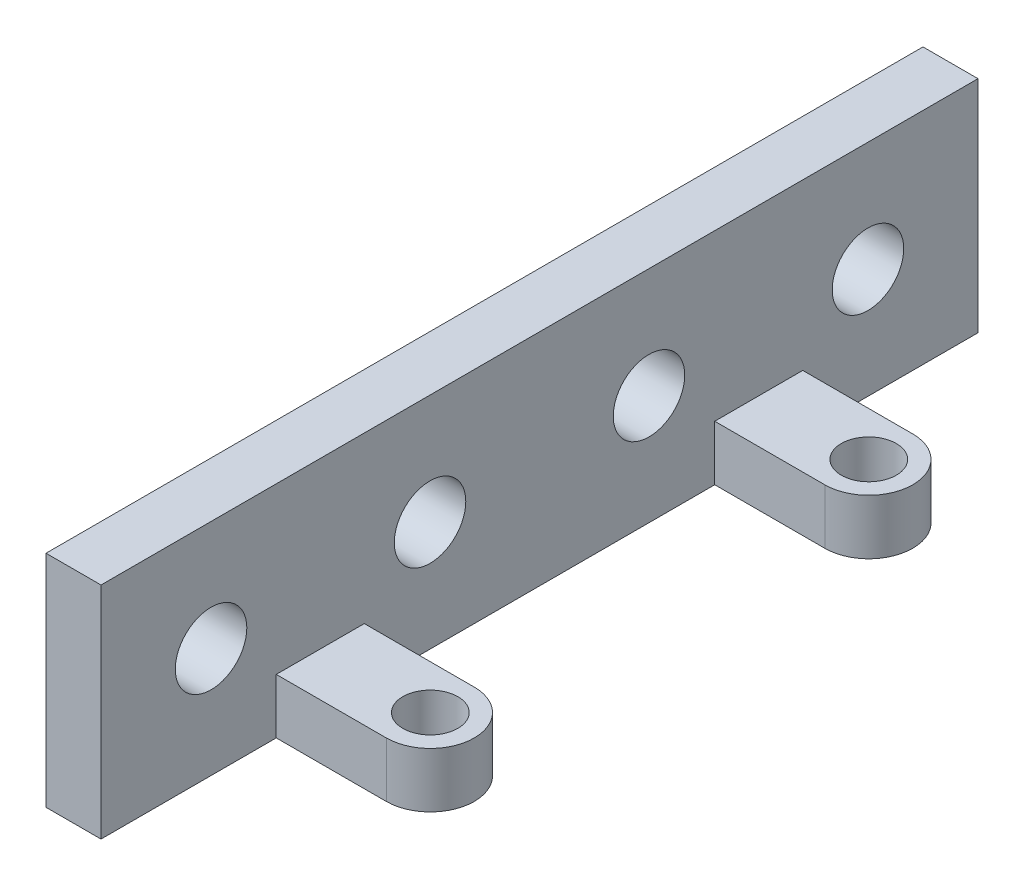
from build123d import *

# Parameters (mm, degrees)
SKETCH1_W           = 79.7
SKETCH1_H           = 20
SKETCH1_R           = 3.25
BOSS_EXTRUDE1_DEPTH = 5
SKETCH2_W           = 8
SKETCH2_H           = 5
BOSS_EXTRUDE2_DEPTH = 10
BOSS_EXTRUDE3_DEPTH = 5
SKETCH3_6_R         = 2.5
CUT_EXTRUDE2_DEPTH  = 84.295197941


with BuildPart() as part:
    # Sketch1 → Boss-Extrude1 (new body)
    with BuildSketch(Plane(origin=(0, 0, 0), x_dir=(0, 0, -1), z_dir=(1, 0, 0))):
        with Locations((-39.85, 10)):
            Rectangle(SKETCH1_W, SKETCH1_H)
        with Locations((-29.9, 10)):
            Circle(SKETCH1_R, mode=Mode.SUBTRACT)
        with Locations((-49.8, 10)):
            Circle(SKETCH1_R, mode=Mode.SUBTRACT)
        with Locations((-69.7, 10)):
            Circle(SKETCH1_R, mode=Mode.SUBTRACT)
        with Locations((-10, 10)):
            Circle(SKETCH1_R, mode=Mode.SUBTRACT)
    extrude(amount=BOSS_EXTRUDE1_DEPTH)

    # Sketch2 → Boss-Extrude2 (add)
    with BuildSketch(Plane(origin=(5, 0, 0), x_dir=(0, 0, -1), z_dir=(1, 0, 0))):
        with Locations((-19.925, 2.5)):
            Rectangle(SKETCH2_W, SKETCH2_H)
        with Locations((-59.775, 2.5)):
            Rectangle(SKETCH2_W, SKETCH2_H)
    extrude(amount=BOSS_EXTRUDE2_DEPTH)

    # Sketch3 → Boss-Extrude3 (add)
    with BuildSketch(Plane(origin=(0, 5, 0), x_dir=(1, 0, 0), z_dir=(0, 1, 0))):
        with BuildLine():
            Line((15, -55.775), (15, -63.775))
            ThreePointArc((15, -63.775), (19, -59.775), (15, -55.775))
        make_face()
    boss_extrude3 = extrude(amount=-BOSS_EXTRUDE3_DEPTH)

    # Sketch3<6> → Cut-Extrude2 (cut, through all)
    with BuildSketch(Plane(origin=(0, 5, 0), x_dir=(1, 0, 0), z_dir=(0, 1, 0))):
        with Locations((15, -59.775)):
            Circle(SKETCH3_6_R)
    cut_extrude2 = extrude(amount=-CUT_EXTRUDE2_DEPTH, mode=Mode.SUBTRACT)

    # Mirror1: Boss-Extrude3, Cut-Extrude2 across plane
    add(boss_extrude3.mirror(Plane.XY.offset(39.85)))
    add(cut_extrude2.mirror(Plane.XY.offset(39.85)), mode=Mode.SUBTRACT)


solid = part.part
